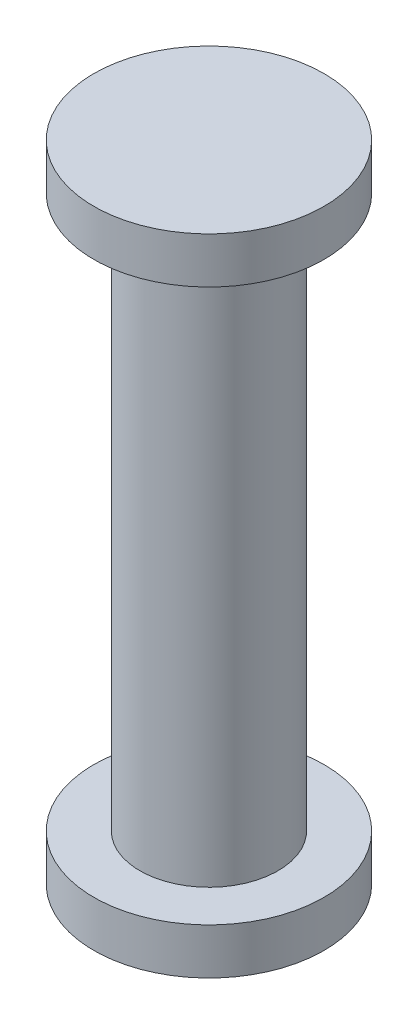
from build123d import *


with BuildPart() as part:
    # Sketch1 → Revolve1 (revolve)
    with BuildSketch(Plane.XY, mode=Mode.PRIVATE) as revolve1_sk:
        Polygon((0, 0), (0, 14), (-2.081698998, 14), (-2.5, 14), (-2.5, 13), (-1.5, 13), (-1.5, 1), (-2.5, 1), (-2.5, 0), align=None)
    revolve(revolve1_sk.sketch.rotate(Axis((0, 0, 0), (0, 1, 0)), 270), axis=Axis((0, 0, 0), (0, 1, 0)))


solid = part.part
